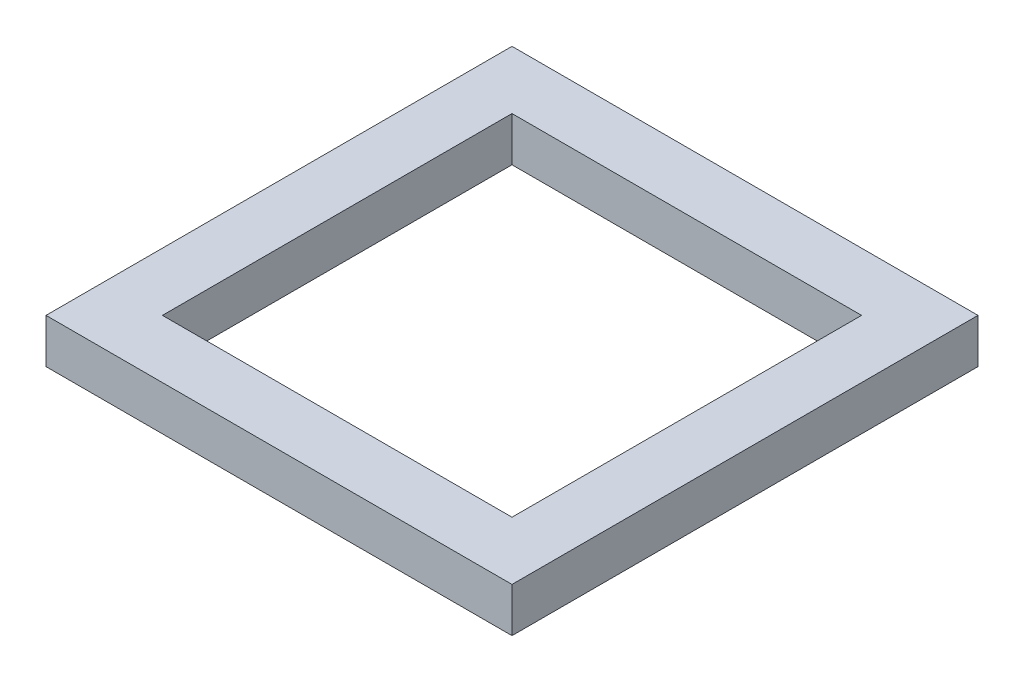
from build123d import *

# Parameters (mm, degrees)
SKETCH1_W           = 53.32
SKETCH1_H           = 53.32
SKETCH1_W_2         = 40
SKETCH1_H_2         = 40
BOSS_EXTRUDE1_DEPTH = 5.08


with BuildPart() as part:
    # Sketch1 → Boss-Extrude1 (new body)
    with BuildSketch(Plane(origin=(0, 0, 0), x_dir=(1, 0, 0), z_dir=(0, 1, 0))):
        with Locations((8.705454545, -0.864545455)):
            Rectangle(SKETCH1_W, SKETCH1_H)
        with Locations((8.705454545, -0.864545455)):
            Rectangle(SKETCH1_W_2, SKETCH1_H_2, mode=Mode.SUBTRACT)
    extrude(amount=BOSS_EXTRUDE1_DEPTH)


solid = part.part
